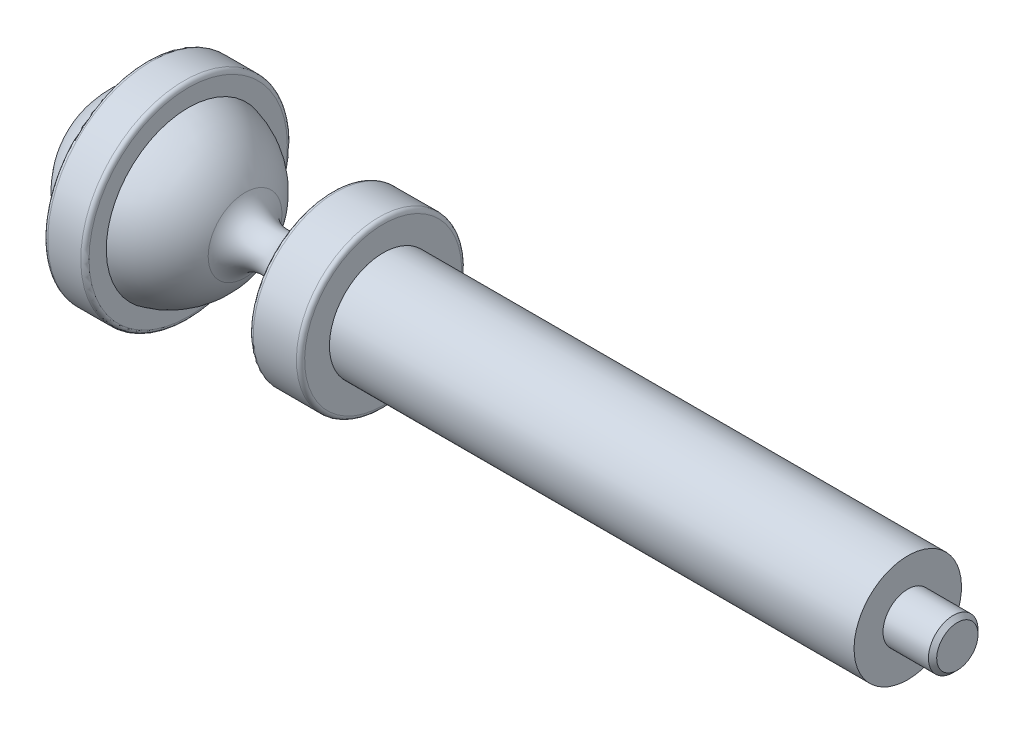
from build123d import *

# Parameters (mm, degrees)
FILLET1_R = 0.5


with BuildPart() as part:
    # Sketch1 → Revolve1 (revolve)
    with BuildSketch(Plane.XY, mode=Mode.PRIVATE) as revolve1_sk:
        with BuildLine():
            Line((0, 0), (105.5, 0))
            Line((105.5, 0), (105.5, 2.5))
            Line((105.5, 2.5), (105, 3))
            Line((105, 3), (99.5, 3))
            Line((99.5, 3), (99.5, 6.5))
            Line((99.5, 6.5), (36, 6.5))
            Line((36, 6.5), (36, 10))
            Line((36, 10), (30, 10))
            Line((30, 10), (26.261285599, 4.084478618))
            ThreePointArc((26.261285599, 4.084478618), (22.662646852, 2.227420735), (19.286779661, 4.464022068))
            ThreePointArc((19.286779661, 4.464022068), (16.462029446, 7.969317716), (12.4, 9.909994955))
            Line((12.4, 9.909994955), (12.4, 12.5))
            Line((12.4, 12.5), (7.4, 12.5))
            Line((7.4, 12.5), (7.4, 9.777934342))
            ThreePointArc((7.4, 9.777934342), (2.058543341, 6.131231524), (0, 0))
        make_face()
    revolve(revolve1_sk.sketch.rotate(Axis((0, 0, 0), (1, 0, 0)), 180), axis=Axis((0, 0, 0), (1, 0, 0)))

    # Fillet1
    fillet1_edges = [part.edges().sort_by_distance(p)[0] for p in [
        (7.4, 12.5, 0),
        (12.4, 12.5, 0),
        (30, 10, 0),
        (36, 10, 0),
    ]]
    fillet(fillet1_edges, radius=FILLET1_R)


solid = part.part
